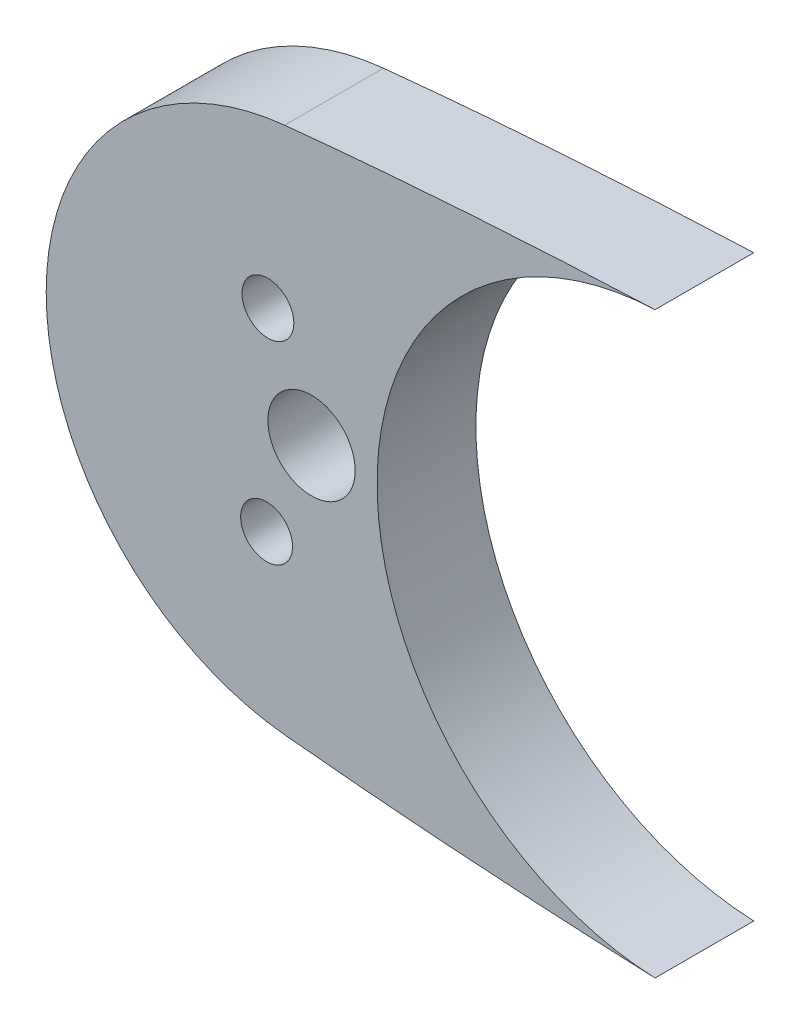
from build123d import *

# Parameters (mm, degrees)
BOSS_EXTRUDE3_START = 4.25
BOSS_EXTRUDE3_DEPTH = 6
SKETCH3_R           = 1.575
CUT_EXTRUDE1_DEPTH  = 10


with BuildPart() as part:
    # Sketch2 → Boss-Extrude3 (new body)
    with BuildSketch(Plane.XY.offset(BOSS_EXTRUDE3_START)):
        with BuildLine():
            ThreePointArc((46.632238895, 16.118255038), (45.815068573, 16.097527081), (45, 16.035396523))
            ThreePointArc((45, 16.035396523), (38.72701102, 14.046548248), (33.771749201, 9.716272448))
            ThreePointArc((33.771749201, 9.716272448), (37.029755518, 5.335725192), (38.184673742, 0))
            Line((38.184673742, 0), (43.982238895, 0))
            ThreePointArc((43.982238895, 0), (44.758405925, 1.87383297), (46.632238895, 2.65))
            Line((46.632238895, 2.65), (46.632238895, 16.118255038))
        make_face()
        with BuildLine():
            ThreePointArc((33.771749201, -9.716272448), (38.72701102, -14.046548248), (45, -16.035396523))
            ThreePointArc((45, -16.035396523), (45.815068573, -16.097527081), (46.632238895, -16.118255038))
            Line((46.632238895, -16.118255038), (46.632238895, -2.65))
            ThreePointArc((46.632238895, -2.65), (44.758405925, -1.87383297), (43.982238895, 0))
            Line((43.982238895, 0), (38.184673742, 0))
            ThreePointArc((38.184673742, 0), (37.029755518, -5.335725192), (33.771749201, -9.716272448))
        make_face()
        with BuildLine():
            ThreePointArc((38.184673742, 0), (37.029755518, 5.335725192), (33.771749201, 9.716272448))
            ThreePointArc((33.771749201, 9.716272448), (31.350112109, 5.123938556), (30.513983858, 0))
            Line((30.513983858, 0), (38.184673742, 0))
        make_face()
        with BuildLine():
            ThreePointArc((30.513983858, 0), (31.350112109, -5.123938556), (33.771749201, -9.716272448))
            ThreePointArc((33.771749201, -9.716272448), (37.029755518, -5.335725192), (38.184673742, 0))
            Line((38.184673742, 0), (30.513983858, 0))
        make_face()
        with BuildLine():
            ThreePointArc((56.268821721, 12.920310248), (51.708915452, 15.297892031), (46.632238895, 16.118255038))
            Line((46.632238895, 16.118255038), (46.632238895, 2.65))
            ThreePointArc((46.632238895, 2.65), (48.506071865, 1.87383297), (49.282238895, 0))
            Line((49.282238895, 0), (50.616596945, 0))
            ThreePointArc((50.616596945, 0), (52.091474062, 7.051277576), (56.268821721, 12.920310248))
        make_face()
        with BuildLine():
            Line((46.632238895, -2.65), (46.632238895, -16.118255038))
            ThreePointArc((46.632238895, -16.118255038), (51.708915452, -15.297892031), (56.268821721, -12.920310248))
            ThreePointArc((56.268821721, -12.920310248), (52.091474062, -7.051277576), (50.616596945, 0))
            Line((50.616596945, 0), (49.282238895, 0))
            ThreePointArc((49.282238895, 0), (48.506071865, -1.87383297), (46.632238895, -2.65))
        make_face()
        with BuildLine():
            add(Edge.make_bspline(
                [(67.5, 17.578928476), (65.61016752, 17.502615465), (60.634413429, 17.271238409), (53.13057404, 16.789010877), (47.524682176, 16.292383273), (45, 16.035396523)],
                knots=[0.381536428, 0.381536428, 0.381536428, 0.381536428, 0.390812303, 0.405965006, 0.418410632, 0.418410632, 0.418410632, 0.418410632], degree=3))
            ThreePointArc((45, 16.035396523), (45.815068573, 16.097527081), (46.632238895, 16.118255038))
            ThreePointArc((46.632238895, 16.118255038), (51.708915452, 15.297892031), (56.268821721, 12.920310248))
            ThreePointArc((56.268821721, 12.920310248), (61.469163108, 16.250714817), (67.5, 17.578928476))
        make_face()
        with BuildLine():
            ThreePointArc((46.632238895, -16.118255038), (45.815068573, -16.097527081), (45, -16.035396523))
            add(Edge.make_bspline(
                [(45, -16.035396523), (47.524682176, -16.292383273), (53.13057404, -16.789010877), (60.634413429, -17.271238409), (65.61016752, -17.502615465), (67.5, -17.578928476)],
                knots=[0.581589368, 0.581589368, 0.581589368, 0.581589368, 0.594034994, 0.609187697, 0.618463572, 0.618463572, 0.618463572, 0.618463572], degree=3))
            ThreePointArc((67.5, -17.578928476), (61.469163108, -16.250714817), (56.268821721, -12.920310248))
            ThreePointArc((56.268821721, -12.920310248), (51.708915452, -15.297892031), (46.632238895, -16.118255038))
        make_face()
    extrude(amount=BOSS_EXTRUDE3_DEPTH)

    # Sketch3 → Cut-Extrude1 (cut)
    with BuildSketch(Plane.XY.offset(10.25)):
        with Locations((43.902744235, -5.9)):
            Circle(SKETCH3_R)
        with Locations((43.982238895, 5.9)):
            Circle(SKETCH3_R)
    extrude(amount=-CUT_EXTRUDE1_DEPTH, mode=Mode.SUBTRACT)


solid = part.part
